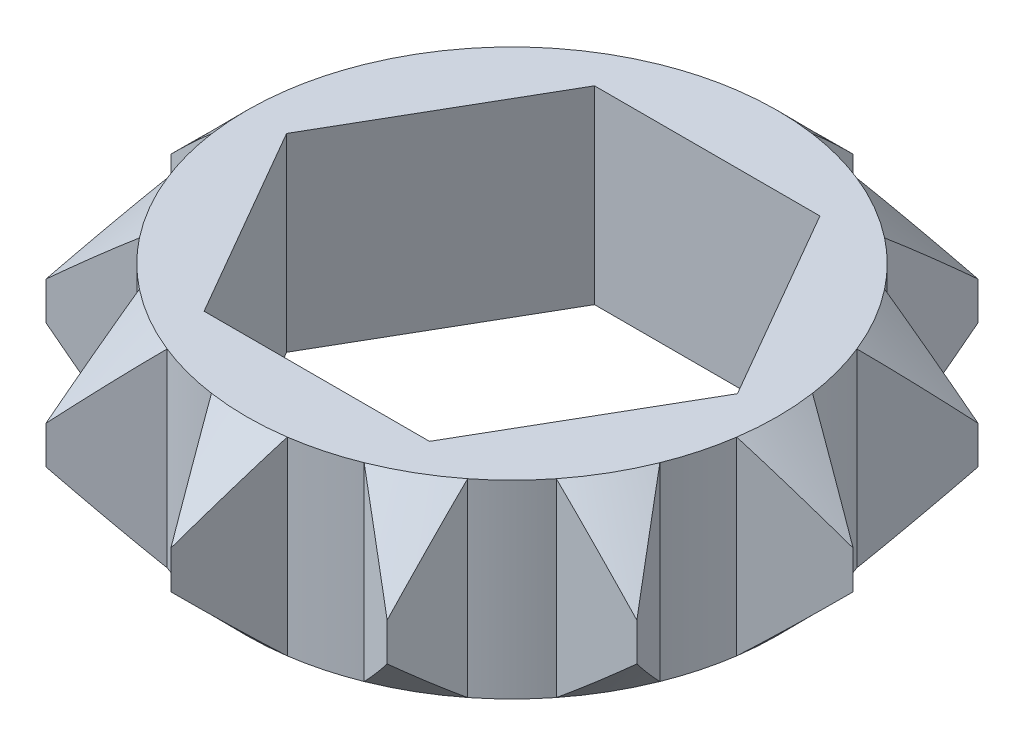
from build123d import *

# Parameters (mm, degrees)
SKETCH1_R           = 8.89
BOSS_EXTRUDE1_DEPTH = 6.35


with BuildPart() as part:
    # Sketch1 → Boss-Extrude1 (new body)
    # profile 1 of 13: a face of its own
    with BuildSketch(Plane(origin=(0, 0, 0), x_dir=(1, 0, 0), z_dir=(0, 1, 0))):
        Circle(SKETCH1_R)
        Polygon((3.776159436, -6.5405), (7.552318871, 0), (3.776159436, 6.5405), (-3.776159436, 6.5405), (-7.552318871, 0), (-3.776159436, -6.5405), align=None, mode=Mode.SUBTRACT)
    # profile 2 of 13: a face of its own
    with BuildSketch(Plane(origin=(0, 0, 0), x_dir=(1, 0, 0), z_dir=(0, 1, 0))):
        with BuildLine():
            ThreePointArc((-8.798818102, -1.27), (-8.89, 0), (-8.798818102, 1.27))
            Line((-8.798818102, 1.27), (-11.43, 0))
            Line((-11.43, 0), (-8.798818102, -1.27))
        make_face()
    # profile 3 of 13: a face of its own
    with BuildSketch(Plane(origin=(0, 0, 0), x_dir=(1, 0, 0), z_dir=(0, 1, 0))):
        with BuildLine():
            ThreePointArc((-6.985, -5.499261314), (-7.69896584, -4.445), (-8.255, -3.299556788))
            Line((-8.255, -3.299556788), (-9.898670365, -5.715))
            Line((-9.898670365, -5.715), (-6.985, -5.499261314))
        make_face()
    # profile 4 of 13: a face of its own
    with BuildSketch(Plane(origin=(0, 0, 0), x_dir=(1, 0, 0), z_dir=(0, 1, 0))):
        with BuildLine():
            ThreePointArc((-3.299556788, -8.255), (-4.445, -7.69896584), (-5.499261314, -6.985))
            Line((-5.499261314, -6.985), (-5.715, -9.898670365))
            Line((-5.715, -9.898670365), (-3.299556788, -8.255))
        make_face()
    # profile 5 of 13: a face of its own
    with BuildSketch(Plane(origin=(0, 0, 0), x_dir=(1, 0, 0), z_dir=(0, 1, 0))):
        with BuildLine():
            ThreePointArc((1.27, -8.798818102), (0, -8.89), (-1.27, -8.798818102))
            Line((-1.27, -8.798818102), (0, -11.43))
            Line((0, -11.43), (1.27, -8.798818102))
        make_face()
    # profile 6 of 13: a face of its own
    with BuildSketch(Plane(origin=(0, 0, 0), x_dir=(1, 0, 0), z_dir=(0, 1, 0))):
        with BuildLine():
            Line((5.715, -9.898670365), (5.499261314, -6.985))
            ThreePointArc((5.499261314, -6.985), (4.445, -7.69896584), (3.299556788, -8.255))
            Line((3.299556788, -8.255), (5.715, -9.898670365))
        make_face()
    # profile 7 of 13: a face of its own
    with BuildSketch(Plane(origin=(0, 0, 0), x_dir=(1, 0, 0), z_dir=(0, 1, 0))):
        with BuildLine():
            Line((9.898670365, -5.715), (8.255, -3.299556788))
            ThreePointArc((8.255, -3.299556788), (7.69896584, -4.445), (6.985, -5.499261314))
            Line((6.985, -5.499261314), (9.898670365, -5.715))
        make_face()
    # profile 8 of 13: a face of its own
    with BuildSketch(Plane(origin=(0, 0, 0), x_dir=(1, 0, 0), z_dir=(0, 1, 0))):
        with BuildLine():
            Line((11.43, 0), (8.798818102, 1.27))
            ThreePointArc((8.798818102, 1.27), (8.867175225, 0.636634538), (8.89, 0))
            ThreePointArc((8.89, 0), (8.867175225, -0.636634538), (8.798818102, -1.27))
            Line((8.798818102, -1.27), (11.43, 0))
        make_face()
    # profile 9 of 13: a face of its own
    with BuildSketch(Plane(origin=(0, 0, 0), x_dir=(1, 0, 0), z_dir=(0, 1, 0))):
        with BuildLine():
            Line((9.898670365, 5.715), (6.985, 5.499261314))
            ThreePointArc((6.985, 5.499261314), (7.69896584, 4.445), (8.255, 3.299556788))
            Line((8.255, 3.299556788), (9.898670365, 5.715))
        make_face()
    # profile 10 of 13: a face of its own
    with BuildSketch(Plane(origin=(0, 0, 0), x_dir=(1, 0, 0), z_dir=(0, 1, 0))):
        with BuildLine():
            Line((5.715, 9.898670365), (3.299556788, 8.255))
            ThreePointArc((3.299556788, 8.255), (4.445, 7.69896584), (5.499261314, 6.985))
            Line((5.499261314, 6.985), (5.715, 9.898670365))
        make_face()
    # profile 11 of 13: a face of its own
    with BuildSketch(Plane(origin=(0, 0, 0), x_dir=(1, 0, 0), z_dir=(0, 1, 0))):
        with BuildLine():
            Line((1.27, 8.798818102), (0, 11.43))
            Line((0, 11.43), (-1.27, 8.798818102))
            ThreePointArc((-1.27, 8.798818102), (0, 8.89), (1.27, 8.798818102))
        make_face()
    # profile 12 of 13: a face of its own
    with BuildSketch(Plane(origin=(0, 0, 0), x_dir=(1, 0, 0), z_dir=(0, 1, 0))):
        with BuildLine():
            ThreePointArc((-5.499261314, 6.985), (-4.445, 7.69896584), (-3.299556788, 8.255))
            Line((-3.299556788, 8.255), (-5.715, 9.898670365))
            Line((-5.715, 9.898670365), (-5.499261314, 6.985))
        make_face()
    # profile 13 of 13: a face of its own
    with BuildSketch(Plane(origin=(0, 0, 0), x_dir=(1, 0, 0), z_dir=(0, 1, 0))):
        with BuildLine():
            ThreePointArc((-8.255, 3.299556788), (-7.69896584, 4.445), (-6.985, 5.499261314))
            Line((-6.985, 5.499261314), (-9.898670365, 5.715))
            Line((-9.898670365, 5.715), (-8.255, 3.299556788))
        make_face()
    extrude(amount=BOSS_EXTRUDE1_DEPTH)

    # Sketch2 → Cut-Revolve1 (revolve, cut)
    with BuildSketch(Plane.XY):
        Polygon((-11.43, 3.81), (-8.89, 6.35), (-11.43, 6.35), align=None)
        Polygon((-11.43, 0), (-8.89, 0), (-11.43, 2.54), align=None)
    revolve(axis=Axis((0, 0, 0), (0, 1, 0)), mode=Mode.SUBTRACT)


solid = part.part
